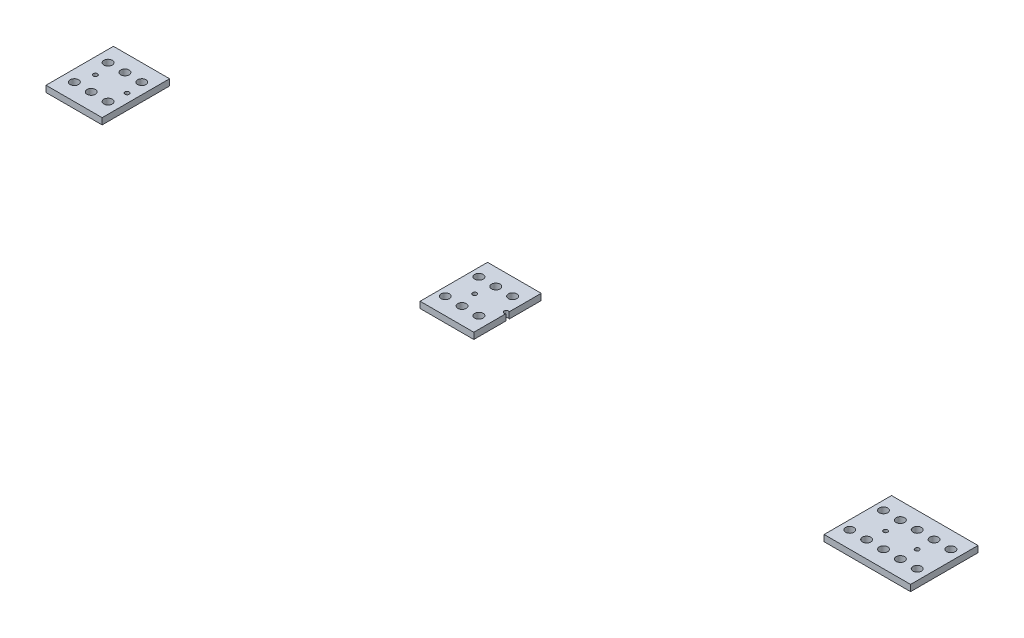
from build123d import *

# Parameters (mm, degrees)
SKETCH_1_W          = 451.256425997
SKETCH_1_H          = 32
SKETCH_1_R          = 2
SKETCH_1_R_2        = 1
EXTRUDE_1_DEPTH     = 3
SKETCH_2_W          = 150.905235642
SKETCH_2_H          = 32
SKETCH_2_W_2        = 166.247314789
SKETCH_2_W_3        = 40.945817217
CUT_EXTRUDE_1_DEPTH = 3


with BuildPart() as part:
    # 草圖1 → 填料-伸長1 (new body)
    with BuildSketch(Plane(origin=(0, 0, 0), x_dir=(1, 0, 0), z_dir=(0, 1, 0))):
        with Locations((211.404131582, 5.700486404)):
            Rectangle(SKETCH_1_W, SKETCH_1_H)
        with Locations(Location((-8.770580193, 13.700486404, 0), (0, 0, 270))):
            Circle(SKETCH_1_R, mode=Mode.SUBTRACT)
        with Locations(Location((-8.770580193, -2.299513596, 0), (0, 0, 270))):
            Circle(SKETCH_1_R, mode=Mode.SUBTRACT)
        with Locations(Location((-0.770580193, 13.700486404, 0), (0, 0, 270))):
            Circle(SKETCH_1_R, mode=Mode.SUBTRACT)
        with Locations(Location((-0.770580193, -2.299513596, 0), (0, 0, 270))):
            Circle(SKETCH_1_R, mode=Mode.SUBTRACT)
        with Locations(Location((7.229419807, 13.700486404, 0), (0, 0, 270))):
            Circle(SKETCH_1_R, mode=Mode.SUBTRACT)
        with Locations(Location((7.229419807, -2.299513596, 0), (0, 0, 270))):
            Circle(SKETCH_1_R, mode=Mode.SUBTRACT)
        with Locations(Location((15.229419807, 13.700486404, 0), (0, 0, 270))):
            Circle(SKETCH_1_R, mode=Mode.SUBTRACT)
        with Locations(Location((15.229419807, -2.299513596, 0), (0, 0, 270))):
            Circle(SKETCH_1_R, mode=Mode.SUBTRACT)
        with Locations(Location((23.229419807, 13.700486404, 0), (0, 0, 270))):
            Circle(SKETCH_1_R, mode=Mode.SUBTRACT)
        with Locations(Location((23.229419807, -2.299513596, 0), (0, 0, 270))):
            Circle(SKETCH_1_R, mode=Mode.SUBTRACT)
        with Locations(Location((31.229419807, 13.700486404, 0), (0, 0, 270))):
            Circle(SKETCH_1_R, mode=Mode.SUBTRACT)
        with Locations(Location((31.229419807, -2.299513596, 0), (0, 0, 270))):
            Circle(SKETCH_1_R, mode=Mode.SUBTRACT)
        with Locations(Location((39.229419807, 13.700486404, 0), (0, 0, 270))):
            Circle(SKETCH_1_R, mode=Mode.SUBTRACT)
        with Locations(Location((39.229419807, -2.299513596, 0), (0, 0, 270))):
            Circle(SKETCH_1_R, mode=Mode.SUBTRACT)
        with Locations(Location((47.229419807, 13.700486404, 0), (0, 0, 270))):
            Circle(SKETCH_1_R, mode=Mode.SUBTRACT)
        with Locations(Location((47.229419807, -2.299513596, 0), (0, 0, 270))):
            Circle(SKETCH_1_R, mode=Mode.SUBTRACT)
        with Locations(Location((55.229419807, 13.700486404, 0), (0, 0, 270))):
            Circle(SKETCH_1_R, mode=Mode.SUBTRACT)
        with Locations(Location((55.229419807, -2.299513596, 0), (0, 0, 270))):
            Circle(SKETCH_1_R, mode=Mode.SUBTRACT)
        with Locations(Location((63.229419807, 13.700486404, 0), (0, 0, 270))):
            Circle(SKETCH_1_R, mode=Mode.SUBTRACT)
        with Locations(Location((63.229419807, -2.299513596, 0), (0, 0, 270))):
            Circle(SKETCH_1_R, mode=Mode.SUBTRACT)
        with Locations(Location((71.229419807, 13.700486404, 0), (0, 0, 270))):
            Circle(SKETCH_1_R, mode=Mode.SUBTRACT)
        with Locations(Location((71.229419807, -2.299513596, 0), (0, 0, 270))):
            Circle(SKETCH_1_R, mode=Mode.SUBTRACT)
        with Locations(Location((79.229419807, 13.700486404, 0), (0, 0, 270))):
            Circle(SKETCH_1_R, mode=Mode.SUBTRACT)
        with Locations(Location((79.229419807, -2.299513596, 0), (0, 0, 270))):
            Circle(SKETCH_1_R, mode=Mode.SUBTRACT)
        with Locations(Location((87.229419807, 13.700486404, 0), (0, 0, 270))):
            Circle(SKETCH_1_R, mode=Mode.SUBTRACT)
        with Locations(Location((87.229419807, -2.299513596, 0), (0, 0, 270))):
            Circle(SKETCH_1_R, mode=Mode.SUBTRACT)
        with Locations(Location((95.229419807, 13.700486404, 0), (0, 0, 270))):
            Circle(SKETCH_1_R, mode=Mode.SUBTRACT)
        with Locations(Location((95.229419807, -2.299513596, 0), (0, 0, 270))):
            Circle(SKETCH_1_R, mode=Mode.SUBTRACT)
        with Locations(Location((103.229419807, 13.700486404, 0), (0, 0, 270))):
            Circle(SKETCH_1_R, mode=Mode.SUBTRACT)
        with Locations(Location((103.229419807, -2.299513596, 0), (0, 0, 270))):
            Circle(SKETCH_1_R, mode=Mode.SUBTRACT)
        with Locations(Location((111.229419807, 13.700486404, 0), (0, 0, 270))):
            Circle(SKETCH_1_R, mode=Mode.SUBTRACT)
        with Locations(Location((111.229419807, -2.299513596, 0), (0, 0, 270))):
            Circle(SKETCH_1_R, mode=Mode.SUBTRACT)
        with Locations(Location((119.229419807, 13.700486404, 0), (0, 0, 270))):
            Circle(SKETCH_1_R, mode=Mode.SUBTRACT)
        with Locations(Location((119.229419807, -2.299513596, 0), (0, 0, 270))):
            Circle(SKETCH_1_R, mode=Mode.SUBTRACT)
        with Locations(Location((127.229419807, 13.700486404, 0), (0, 0, 270))):
            Circle(SKETCH_1_R, mode=Mode.SUBTRACT)
        with Locations(Location((127.229419807, -2.299513596, 0), (0, 0, 270))):
            Circle(SKETCH_1_R, mode=Mode.SUBTRACT)
        with Locations(Location((135.229419807, 13.700486404, 0), (0, 0, 270))):
            Circle(SKETCH_1_R, mode=Mode.SUBTRACT)
        with Locations(Location((135.229419807, -2.299513596, 0), (0, 0, 270))):
            Circle(SKETCH_1_R, mode=Mode.SUBTRACT)
        with Locations(Location((143.229419807, 13.700486404, 0), (0, 0, 270))):
            Circle(SKETCH_1_R, mode=Mode.SUBTRACT)
        with Locations(Location((143.229419807, -2.299513596, 0), (0, 0, 270))):
            Circle(SKETCH_1_R, mode=Mode.SUBTRACT)
        with Locations(Location((151.229419807, 13.700486404, 0), (0, 0, 270))):
            Circle(SKETCH_1_R, mode=Mode.SUBTRACT)
        with Locations(Location((151.229419807, -2.299513596, 0), (0, 0, 270))):
            Circle(SKETCH_1_R, mode=Mode.SUBTRACT)
        with Locations(Location((159.229419807, 13.700486404, 0), (0, 0, 270))):
            Circle(SKETCH_1_R, mode=Mode.SUBTRACT)
        with Locations(Location((159.229419807, -2.299513596, 0), (0, 0, 270))):
            Circle(SKETCH_1_R, mode=Mode.SUBTRACT)
        with Locations(Location((167.229419807, 13.700486404, 0), (0, 0, 270))):
            Circle(SKETCH_1_R, mode=Mode.SUBTRACT)
        with Locations(Location((167.229419807, -2.299513596, 0), (0, 0, 270))):
            Circle(SKETCH_1_R, mode=Mode.SUBTRACT)
        with Locations(Location((175.229419807, 13.700486404, 0), (0, 0, 270))):
            Circle(SKETCH_1_R, mode=Mode.SUBTRACT)
        with Locations(Location((175.229419807, -2.299513596, 0), (0, 0, 270))):
            Circle(SKETCH_1_R, mode=Mode.SUBTRACT)
        with Locations(Location((183.229419807, 13.700486404, 0), (0, 0, 270))):
            Circle(SKETCH_1_R, mode=Mode.SUBTRACT)
        with Locations(Location((183.229419807, -2.299513596, 0), (0, 0, 270))):
            Circle(SKETCH_1_R, mode=Mode.SUBTRACT)
        with Locations(Location((191.229419807, 13.700486404, 0), (0, 0, 270))):
            Circle(SKETCH_1_R, mode=Mode.SUBTRACT)
        with Locations(Location((191.229419807, -2.299513596, 0), (0, 0, 270))):
            Circle(SKETCH_1_R, mode=Mode.SUBTRACT)
        with Locations(Location((199.229419807, 13.700486404, 0), (0, 0, 270))):
            Circle(SKETCH_1_R, mode=Mode.SUBTRACT)
        with Locations(Location((199.229419807, -2.299513596, 0), (0, 0, 270))):
            Circle(SKETCH_1_R, mode=Mode.SUBTRACT)
        with Locations(Location((207.229419807, 13.700486404, 0), (0, 0, 270))):
            Circle(SKETCH_1_R, mode=Mode.SUBTRACT)
        with Locations(Location((207.229419807, -2.299513596, 0), (0, 0, 270))):
            Circle(SKETCH_1_R, mode=Mode.SUBTRACT)
        with Locations(Location((215.229419807, 13.700486404, 0), (0, 0, 270))):
            Circle(SKETCH_1_R, mode=Mode.SUBTRACT)
        with Locations(Location((215.229419807, -2.299513596, 0), (0, 0, 270))):
            Circle(SKETCH_1_R, mode=Mode.SUBTRACT)
        with Locations(Location((223.229419807, 13.700486404, 0), (0, 0, 270))):
            Circle(SKETCH_1_R, mode=Mode.SUBTRACT)
        with Locations(Location((223.229419807, -2.299513596, 0), (0, 0, 270))):
            Circle(SKETCH_1_R, mode=Mode.SUBTRACT)
        with Locations(Location((231.229419807, 13.700486404, 0), (0, 0, 270))):
            Circle(SKETCH_1_R, mode=Mode.SUBTRACT)
        with Locations(Location((231.229419807, -2.299513596, 0), (0, 0, 270))):
            Circle(SKETCH_1_R, mode=Mode.SUBTRACT)
        with Locations(Location((239.229419807, 13.700486404, 0), (0, 0, 270))):
            Circle(SKETCH_1_R, mode=Mode.SUBTRACT)
        with Locations(Location((239.229419807, -2.299513596, 0), (0, 0, 270))):
            Circle(SKETCH_1_R, mode=Mode.SUBTRACT)
        with Locations(Location((247.229419807, 13.700486404, 0), (0, 0, 270))):
            Circle(SKETCH_1_R, mode=Mode.SUBTRACT)
        with Locations(Location((247.229419807, -2.299513596, 0), (0, 0, 270))):
            Circle(SKETCH_1_R, mode=Mode.SUBTRACT)
        with Locations(Location((255.229419807, 13.700486404, 0), (0, 0, 270))):
            Circle(SKETCH_1_R, mode=Mode.SUBTRACT)
        with Locations(Location((255.229419807, -2.299513596, 0), (0, 0, 270))):
            Circle(SKETCH_1_R, mode=Mode.SUBTRACT)
        with Locations(Location((263.229419807, 13.700486404, 0), (0, 0, 270))):
            Circle(SKETCH_1_R, mode=Mode.SUBTRACT)
        with Locations(Location((263.229419807, -2.299513596, 0), (0, 0, 270))):
            Circle(SKETCH_1_R, mode=Mode.SUBTRACT)
        with Locations(Location((271.229419807, 13.700486404, 0), (0, 0, 270))):
            Circle(SKETCH_1_R, mode=Mode.SUBTRACT)
        with Locations(Location((271.229419807, -2.299513596, 0), (0, 0, 270))):
            Circle(SKETCH_1_R, mode=Mode.SUBTRACT)
        with Locations(Location((279.229419807, 13.700486404, 0), (0, 0, 270))):
            Circle(SKETCH_1_R, mode=Mode.SUBTRACT)
        with Locations(Location((279.229419807, -2.299513596, 0), (0, 0, 270))):
            Circle(SKETCH_1_R, mode=Mode.SUBTRACT)
        with Locations(Location((287.229419807, 13.700486404, 0), (0, 0, 270))):
            Circle(SKETCH_1_R, mode=Mode.SUBTRACT)
        with Locations(Location((287.229419807, -2.299513596, 0), (0, 0, 270))):
            Circle(SKETCH_1_R, mode=Mode.SUBTRACT)
        with Locations(Location((295.229419807, 13.700486404, 0), (0, 0, 270))):
            Circle(SKETCH_1_R, mode=Mode.SUBTRACT)
        with Locations(Location((295.229419807, -2.299513596, 0), (0, 0, 270))):
            Circle(SKETCH_1_R, mode=Mode.SUBTRACT)
        with Locations(Location((303.229419807, 13.700486404, 0), (0, 0, 270))):
            Circle(SKETCH_1_R, mode=Mode.SUBTRACT)
        with Locations(Location((303.229419807, -2.299513596, 0), (0, 0, 270))):
            Circle(SKETCH_1_R, mode=Mode.SUBTRACT)
        with Locations(Location((311.229419807, 13.700486404, 0), (0, 0, 270))):
            Circle(SKETCH_1_R, mode=Mode.SUBTRACT)
        with Locations(Location((311.229419807, -2.299513596, 0), (0, 0, 270))):
            Circle(SKETCH_1_R, mode=Mode.SUBTRACT)
        with Locations(Location((319.229419807, 13.700486404, 0), (0, 0, 270))):
            Circle(SKETCH_1_R, mode=Mode.SUBTRACT)
        with Locations(Location((319.229419807, -2.299513596, 0), (0, 0, 270))):
            Circle(SKETCH_1_R, mode=Mode.SUBTRACT)
        with Locations(Location((327.229419807, 13.700486404, 0), (0, 0, 270))):
            Circle(SKETCH_1_R, mode=Mode.SUBTRACT)
        with Locations(Location((327.229419807, -2.299513596, 0), (0, 0, 270))):
            Circle(SKETCH_1_R, mode=Mode.SUBTRACT)
        with Locations(Location((335.229419807, 13.700486404, 0), (0, 0, 270))):
            Circle(SKETCH_1_R, mode=Mode.SUBTRACT)
        with Locations(Location((335.229419807, -2.299513596, 0), (0, 0, 270))):
            Circle(SKETCH_1_R, mode=Mode.SUBTRACT)
        with Locations(Location((343.229419807, 13.700486404, 0), (0, 0, 270))):
            Circle(SKETCH_1_R, mode=Mode.SUBTRACT)
        with Locations(Location((343.229419807, -2.299513596, 0), (0, 0, 270))):
            Circle(SKETCH_1_R, mode=Mode.SUBTRACT)
        with Locations(Location((351.229419807, 13.700486404, 0), (0, 0, 270))):
            Circle(SKETCH_1_R, mode=Mode.SUBTRACT)
        with Locations(Location((351.229419807, -2.299513596, 0), (0, 0, 270))):
            Circle(SKETCH_1_R, mode=Mode.SUBTRACT)
        with Locations(Location((359.229419807, 13.700486404, 0), (0, 0, 270))):
            Circle(SKETCH_1_R, mode=Mode.SUBTRACT)
        with Locations(Location((359.229419807, -2.299513596, 0), (0, 0, 270))):
            Circle(SKETCH_1_R, mode=Mode.SUBTRACT)
        with Locations(Location((367.229419807, 13.700486404, 0), (0, 0, 270))):
            Circle(SKETCH_1_R, mode=Mode.SUBTRACT)
        with Locations(Location((367.229419807, -2.299513596, 0), (0, 0, 270))):
            Circle(SKETCH_1_R, mode=Mode.SUBTRACT)
        with Locations(Location((375.229419807, 13.700486404, 0), (0, 0, 270))):
            Circle(SKETCH_1_R, mode=Mode.SUBTRACT)
        with Locations(Location((375.229419807, -2.299513596, 0), (0, 0, 270))):
            Circle(SKETCH_1_R, mode=Mode.SUBTRACT)
        with Locations(Location((383.229419807, 13.700486404, 0), (0, 0, 270))):
            Circle(SKETCH_1_R, mode=Mode.SUBTRACT)
        with Locations(Location((383.229419807, -2.299513596, 0), (0, 0, 270))):
            Circle(SKETCH_1_R, mode=Mode.SUBTRACT)
        with Locations(Location((391.229419807, 13.700486404, 0), (0, 0, 270))):
            Circle(SKETCH_1_R, mode=Mode.SUBTRACT)
        with Locations(Location((391.229419807, -2.299513596, 0), (0, 0, 270))):
            Circle(SKETCH_1_R, mode=Mode.SUBTRACT)
        with Locations(Location((399.229419807, 13.700486404, 0), (0, 0, 270))):
            Circle(SKETCH_1_R, mode=Mode.SUBTRACT)
        with Locations(Location((399.229419807, -2.299513596, 0), (0, 0, 270))):
            Circle(SKETCH_1_R, mode=Mode.SUBTRACT)
        with Locations(Location((407.229419807, 13.700486404, 0), (0, 0, 270))):
            Circle(SKETCH_1_R, mode=Mode.SUBTRACT)
        with Locations(Location((407.229419807, -2.299513596, 0), (0, 0, 270))):
            Circle(SKETCH_1_R, mode=Mode.SUBTRACT)
        with Locations(Location((415.229419807, 13.700486404, 0), (0, 0, 270))):
            Circle(SKETCH_1_R, mode=Mode.SUBTRACT)
        with Locations(Location((415.229419807, -2.299513596, 0), (0, 0, 270))):
            Circle(SKETCH_1_R, mode=Mode.SUBTRACT)
        with Locations(Location((423.229419807, 13.700486404, 0), (0, 0, 270))):
            Circle(SKETCH_1_R, mode=Mode.SUBTRACT)
        with Locations(Location((423.229419807, -2.299513596, 0), (0, 0, 270))):
            Circle(SKETCH_1_R, mode=Mode.SUBTRACT)
        with Locations(Location((431.229419807, 13.700486404, 0), (0, 0, 270))):
            Circle(SKETCH_1_R, mode=Mode.SUBTRACT)
        with Locations(Location((431.229419807, -2.299513596, 0), (0, 0, 270))):
            Circle(SKETCH_1_R, mode=Mode.SUBTRACT)
        with Locations(Location((-6.770580193, 5.700486404, 0), (0, 0, 270))):
            Circle(SKETCH_1_R_2, mode=Mode.SUBTRACT)
        with Locations(Location((8.229419807, 5.700486404, 0), (0, 0, 270))):
            Circle(SKETCH_1_R_2, mode=Mode.SUBTRACT)
        with Locations(Location((23.229419807, 5.700486404, 0), (0, 0, 270))):
            Circle(SKETCH_1_R_2, mode=Mode.SUBTRACT)
        with Locations(Location((38.229419807, 5.700486404, 0), (0, 0, 270))):
            Circle(SKETCH_1_R_2, mode=Mode.SUBTRACT)
        with Locations(Location((53.229419807, 5.700486404, 0), (0, 0, 270))):
            Circle(SKETCH_1_R_2, mode=Mode.SUBTRACT)
        with Locations(Location((68.229419807, 5.700486404, 0), (0, 0, 270))):
            Circle(SKETCH_1_R_2, mode=Mode.SUBTRACT)
        with Locations(Location((83.229419807, 5.700486404, 0), (0, 0, 270))):
            Circle(SKETCH_1_R_2, mode=Mode.SUBTRACT)
        with Locations(Location((98.229419807, 5.700486404, 0), (0, 0, 270))):
            Circle(SKETCH_1_R_2, mode=Mode.SUBTRACT)
        with Locations(Location((113.229419807, 5.700486404, 0), (0, 0, 270))):
            Circle(SKETCH_1_R_2, mode=Mode.SUBTRACT)
        with Locations(Location((128.229419807, 5.700486404, 0), (0, 0, 270))):
            Circle(SKETCH_1_R_2, mode=Mode.SUBTRACT)
        with Locations(Location((143.229419807, 5.700486404, 0), (0, 0, 270))):
            Circle(SKETCH_1_R_2, mode=Mode.SUBTRACT)
        with Locations(Location((158.229419807, 5.700486404, 0), (0, 0, 270))):
            Circle(SKETCH_1_R_2, mode=Mode.SUBTRACT)
        with Locations(Location((173.229419807, 5.700486404, 0), (0, 0, 270))):
            Circle(SKETCH_1_R_2, mode=Mode.SUBTRACT)
        with Locations(Location((188.229419807, 5.700486404, 0), (0, 0, 270))):
            Circle(SKETCH_1_R_2, mode=Mode.SUBTRACT)
        with Locations(Location((203.229419807, 5.700486404, 0), (0, 0, 270))):
            Circle(SKETCH_1_R_2, mode=Mode.SUBTRACT)
        with Locations(Location((218.229419807, 5.700486404, 0), (0, 0, 270))):
            Circle(SKETCH_1_R_2, mode=Mode.SUBTRACT)
        with Locations(Location((233.229419807, 5.700486404, 0), (0, 0, 270))):
            Circle(SKETCH_1_R_2, mode=Mode.SUBTRACT)
        with Locations(Location((248.229419807, 5.700486404, 0), (0, 0, 270))):
            Circle(SKETCH_1_R_2, mode=Mode.SUBTRACT)
        with Locations(Location((263.229419807, 5.700486404, 0), (0, 0, 270))):
            Circle(SKETCH_1_R_2, mode=Mode.SUBTRACT)
        with Locations(Location((278.229419807, 5.700486404, 0), (0, 0, 270))):
            Circle(SKETCH_1_R_2, mode=Mode.SUBTRACT)
        with Locations(Location((293.229419807, 5.700486404, 0), (0, 0, 270))):
            Circle(SKETCH_1_R_2, mode=Mode.SUBTRACT)
        with Locations(Location((308.229419807, 5.700486404, 0), (0, 0, 270))):
            Circle(SKETCH_1_R_2, mode=Mode.SUBTRACT)
        with Locations(Location((323.229419807, 5.700486404, 0), (0, 0, 270))):
            Circle(SKETCH_1_R_2, mode=Mode.SUBTRACT)
        with Locations(Location((338.229419807, 5.700486404, 0), (0, 0, 270))):
            Circle(SKETCH_1_R_2, mode=Mode.SUBTRACT)
        with Locations(Location((353.229419807, 5.700486404, 0), (0, 0, 270))):
            Circle(SKETCH_1_R_2, mode=Mode.SUBTRACT)
        with Locations(Location((368.229419807, 5.700486404, 0), (0, 0, 270))):
            Circle(SKETCH_1_R_2, mode=Mode.SUBTRACT)
        with Locations(Location((383.229419807, 5.700486404, 0), (0, 0, 270))):
            Circle(SKETCH_1_R_2, mode=Mode.SUBTRACT)
    extrude(amount=EXTRUDE_1_DEPTH)

    # 草圖2 → 除料-伸長1 (cut)
    with BuildSketch(Plane(origin=(0, 3, 0), x_dir=(1, 0, 0), z_dir=(0, 1, 0))):
        with Locations((87.872936127, 5.700486404)):
            Rectangle(SKETCH_2_W, SKETCH_2_H)
        with Locations((271.926298668, 5.700486404)):
            Rectangle(SKETCH_2_W_2, SKETCH_2_H)
        with Locations((416.559435972, 5.700486404)):
            Rectangle(SKETCH_2_W_3, SKETCH_2_H)
    extrude(amount=-CUT_EXTRUDE_1_DEPTH, mode=Mode.SUBTRACT)


with BuildPart() as cut_extrude_1_piece_1:
    # of the separate pieces the step leaves, piece 1, a body of its own (cut_extrude_1_pieces)
    add(part.part.solids().sort_by_distance((396.086527363, 0, -21.700486404))[0])


with BuildPart() as cut_extrude_1_piece_2:
    # of the separate pieces the step leaves, piece 2, a body of its own (cut_extrude_1_pieces)
    add(part.part.solids().sort_by_distance((12.420318306, 0, -21.700486404))[0])


with BuildPart() as cut_extrude_1_piece_3:
    # of the separate pieces the step leaves, piece 3, a body of its own (cut_extrude_1_pieces)
    add(part.part.solids().sort_by_distance((188.802641273, 0, -21.700486404))[0])


solid = Compound([cut_extrude_1_piece_1.part, cut_extrude_1_piece_2.part, cut_extrude_1_piece_3.part])
